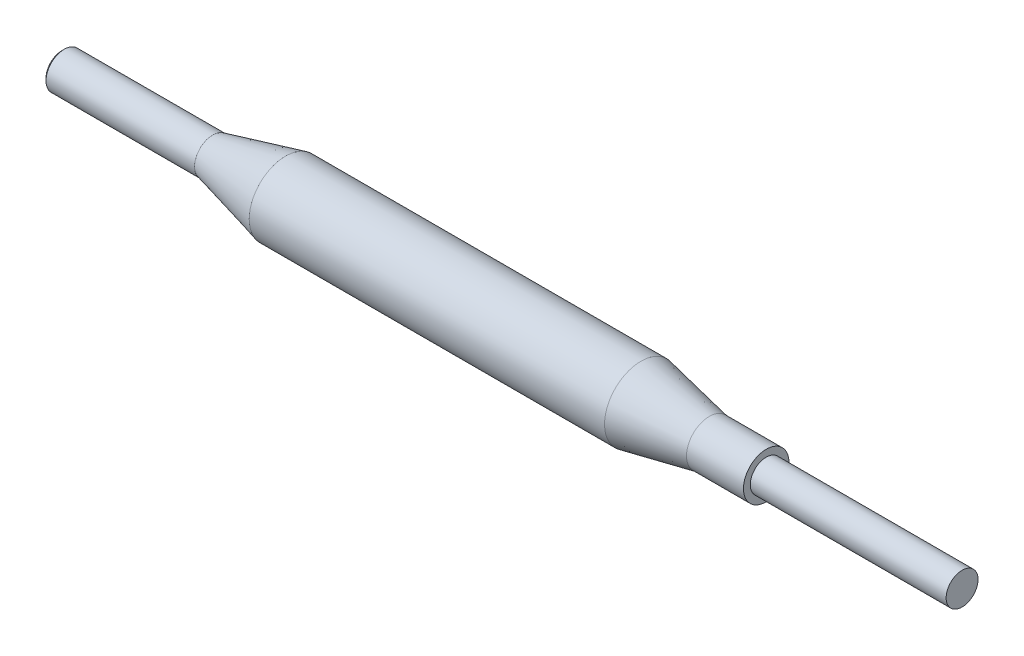
from build123d import *

# Parameters (mm, degrees)
PAH1_SIZE = 0.5


with BuildPart() as part:
    # Çizim1 → Döndür1 (revolve)
    with BuildSketch(Plane.XY, mode=Mode.PRIVATE) as d_nd_r1_sk:
        Polygon((1.89, 4), (35, 4), (51, 8), (129, 8), (144, 5), (154.5, 5), (156.49, 5), (156.49, 3.5), (198.5, 3.5), (199.49, 3.5), (199.49, 0), (198.5, 0), (1.89, 0), align=None)
    revolve(d_nd_r1_sk.sketch.rotate(Axis((1.89, 0, 0), (1, 0, 0)), 90), axis=Axis((1.89, 0, 0), (1, 0, 0)))

    # Pah1
    pah1_edges = [part.edges().sort_by_distance(p)[0] for p in [
        (1.89, 0, -4),
    ]]
    chamfer(pah1_edges, length=PAH1_SIZE)


solid = part.part
